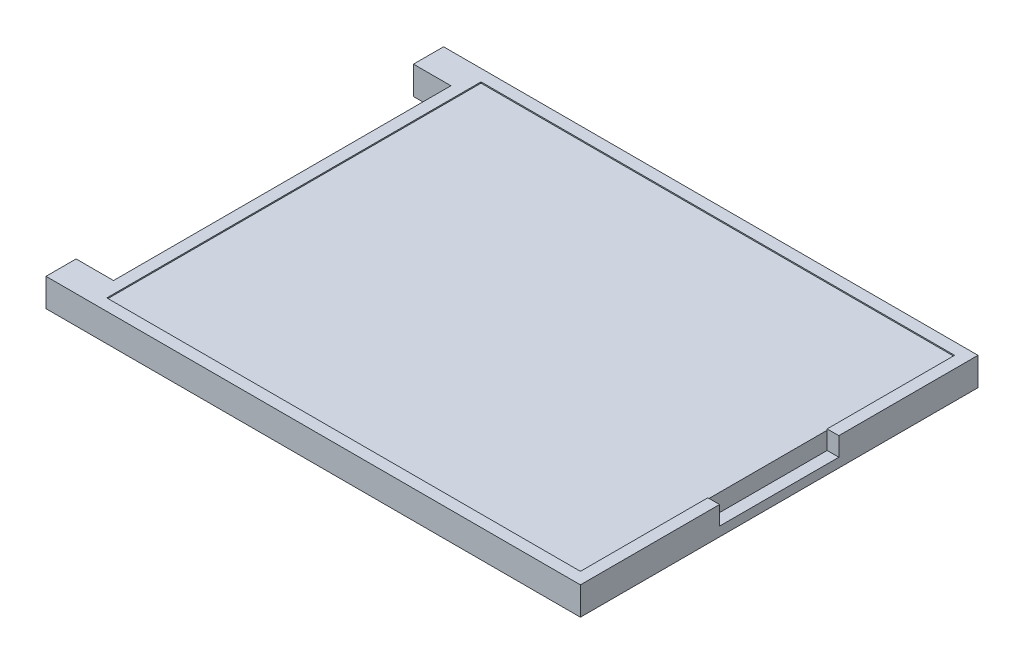
from build123d import *

# Parameters (mm, degrees)
SKETCH1_W           = 49.6
SKETCH1_H           = 34
BOSS_EXTRUDE1_DEPTH = 1.7
BOSS_EXTRUDE2_DEPTH = 2.4
SKETCH4_W           = 40.5
SKETCH4_H           = 32
CUT_EXTRUDE1_DEPTH  = 0.1
SKETCH5_W           = 1
SKETCH5_H           = 10.2
CUT_EXTRUDE2_DEPTH  = 1.6
SKETCH7_W           = 49.6
SKETCH7_H           = 34
CUT_EXTRUDE3_DEPTH  = 1.7


with BuildPart() as part:
    # Sketch1 → Boss-Extrude1 (new body)
    with BuildSketch(Plane(origin=(0, 0, 0), x_dir=(1, 0, 0), z_dir=(0, 1, 0))):
        Rectangle(SKETCH1_W, SKETCH1_H)
    extrude(amount=BOSS_EXTRUDE1_DEPTH)

    # Sketch7 → Cut-Extrude3 (cut)
    with BuildSketch(Plane.XZ):
        Rectangle(SKETCH7_W, SKETCH7_H)
    extrude(amount=-CUT_EXTRUDE3_DEPTH, mode=Mode.SUBTRACT)


with BuildPart() as body_2:
    # Sketch3 → Boss-Extrude2 (new body)
    with BuildSketch(Plane(origin=(0, 1.7, 0), x_dir=(1, 0, 0), z_dir=(0, 1, 0))):
        Polygon((24.8, -17), (24.8, 17), (-20.9, 17), (-20.9, 14.425), (-17.7, 14.425), (-17.7, -14.425), (-20.9, -14.425), (-20.9, -17), align=None)
    extrude(amount=BOSS_EXTRUDE2_DEPTH)

    # Sketch4 → Cut-Extrude1 (cut)
    with BuildSketch(Plane(origin=(0, 4.1, 0), x_dir=(1, 0, 0), z_dir=(0, 1, 0))):
        with Locations((3.55, 0)):
            Rectangle(SKETCH4_W, SKETCH4_H)
    extrude(amount=-CUT_EXTRUDE1_DEPTH, mode=Mode.SUBTRACT)

    # Sketch5 → Cut-Extrude2 (cut)
    with BuildSketch(Plane(origin=(0, 4.1, 0), x_dir=(1, 0, 0), z_dir=(0, 1, 0))):
        with Locations((24.3, 0)):
            Rectangle(SKETCH5_W, SKETCH5_H)
    extrude(amount=-CUT_EXTRUDE2_DEPTH, mode=Mode.SUBTRACT)


solid = body_2.part
